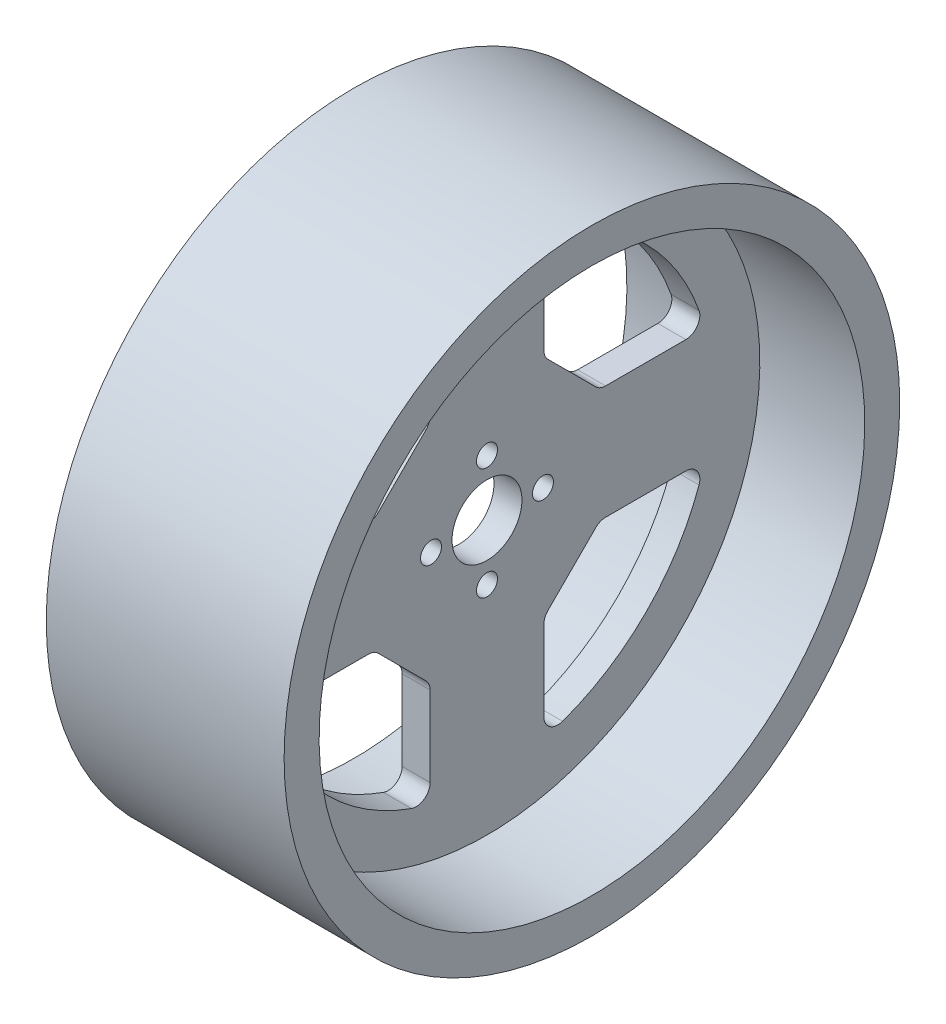
from build123d import *

# Parameters (mm, degrees)
SKETCH2_R                = 5
SKETCH2_R_2              = 1.5
HOLES_DEPTH              = 4
SPOKES_DEPTH             = 4
FILLET2_R                = 2
CIRPATTERN2_COUNT        = 4
FILLET2_OF_CIRPATTERN2_R = 2


with BuildPart() as part:
    # Sketch1 → Revolve1 (revolve)
    with BuildSketch(Plane.XY):
        Polygon((2, 0), (2, 39), (17, 39), (17, 44), (0, 44), (0, 0), align=None)
    revolve1 = revolve(axis=Axis((2, 0, 0), (-1, 0, 0)))

    # Mirror1: Revolve1 across plane
    add(revolve1.mirror(Plane.ZY))

    # Sketch2 → holes (cut)
    with BuildSketch(Plane(origin=(2, 0, 0), x_dir=(0, 0, -1), z_dir=(1, 0, 0))):
        with Locations(Location((0, 0, 0), (0, 0, 90))):
            Circle(SKETCH2_R)
        with Locations(Location((8, 0, 0), (0, 0, 90))):
            Circle(SKETCH2_R_2)
        with Locations(Location((0, -8, 0), (0, 0, 90))):
            Circle(SKETCH2_R_2)
        with Locations(Location((-8, 0, 0), (0, 0, 90))):
            Circle(SKETCH2_R_2)
        with Locations(Location((0, 8, 0), (0, 0, 90))):
            Circle(SKETCH2_R_2)
    extrude(amount=-HOLES_DEPTH, mode=Mode.SUBTRACT)

    # Sketch3 → spokes (cut)
    with BuildSketch(Plane(origin=(2, 0, 0), x_dir=(0, 0, -1), z_dir=(1, 0, 0))):
        with BuildLine():
            Line((8.131727984, 16.131727984), (16.131727984, 8.131727984))
            Line((16.131727984, 8.131727984), (31.131727984, 8.131727984))
            ThreePointArc((31.131727984, 8.131727984), (22.752027242, 22.752027242), (8.131727984, 31.131727984))
            Line((8.131727984, 31.131727984), (8.131727984, 16.131727984))
        make_face()
    spokes = extrude(amount=-SPOKES_DEPTH, mode=Mode.SUBTRACT)

    # Fillet2
    fillet2_edges = [part.edges().sort_by_distance(p)[0] for p in [
        (0, 16.131727984, -8.131727984),
        (0, 8.131727984, -16.131727984),
        (0, 8.131727984, -31.131727984),
        (0, 31.131727984, -8.131727984),
    ]]
    fillet(fillet2_edges, radius=FILLET2_R)

    # CirPattern2: spokes ×4 about axis
    cirpattern2_axis = Axis((0, 0, 0), (1, 0, 0))
    for i in range(1, CIRPATTERN2_COUNT):
        add(spokes.rotate(cirpattern2_axis, i * 360 / CIRPATTERN2_COUNT), mode=Mode.SUBTRACT)

    # Fillet2 of CirPattern2
    fillet2_of_cirpattern2_edges = [part.edges().sort_by_distance(p)[0] for p in [
        (0, 8.131727984, 16.131727984),
        (0, 16.131727984, 8.131727984),
        (0, 31.131727984, 8.131727984),
        (0, 8.131727984, 31.131727984),
        (0, -16.131727984, 8.131727984),
        (0, -8.131727984, 16.131727984),
        (0, -8.131727984, 31.131727984),
        (0, -31.131727984, 8.131727984),
        (0, -8.131727984, -16.131727984),
        (0, -16.131727984, -8.131727984),
        (0, -31.131727984, -8.131727984),
        (0, -8.131727984, -31.131727984),
    ]]
    fillet(fillet2_of_cirpattern2_edges, radius=FILLET2_OF_CIRPATTERN2_R)


solid = part.part
